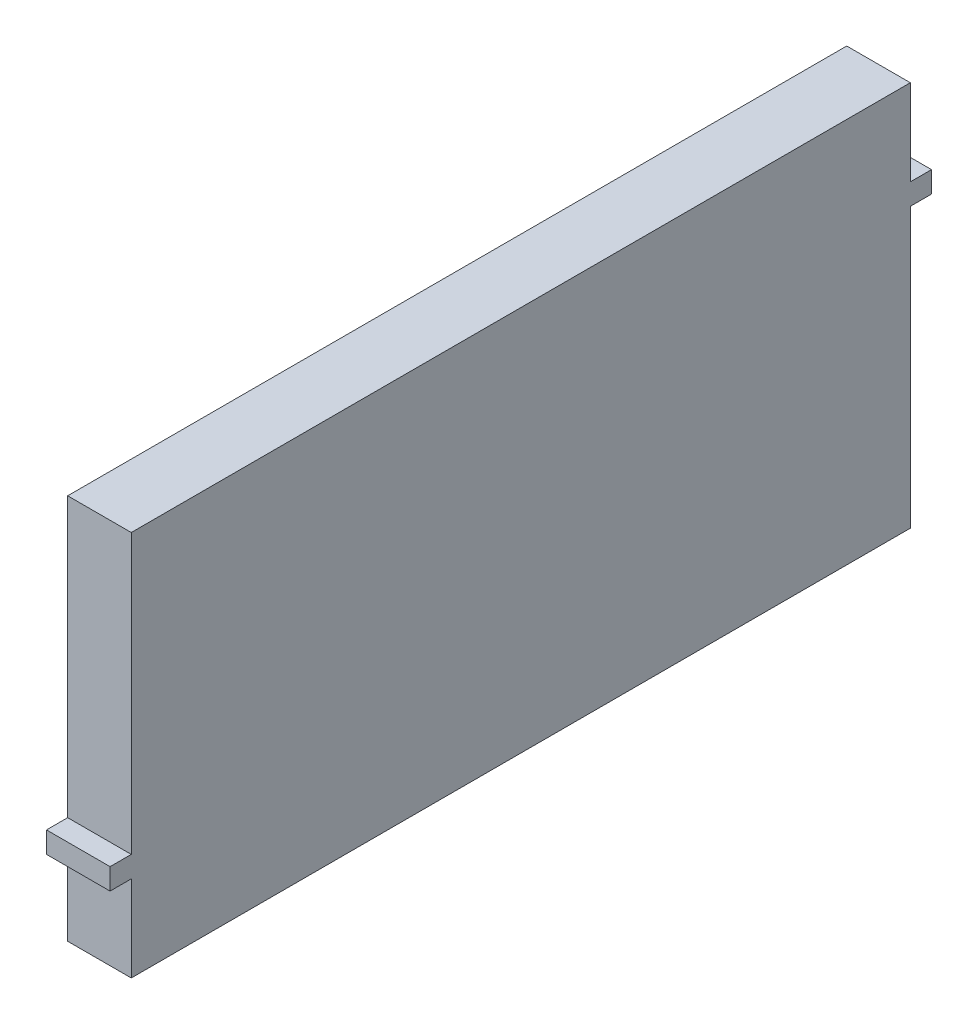
from build123d import *

# Parameters (mm, degrees)
BOSS_EXTRUDE1_DEPTH = 9.525


with BuildPart() as part:
    # Sketch1 → Boss-Extrude1 (new body)
    with BuildSketch(Plane(origin=(243.017706631, 0, 0), x_dir=(0, 0, -1), z_dir=(1, 0, 0))):
        Polygon((-439.537444078, 406.659208455), (-442.712444078, 406.659208455), (-442.712444078, 419.517958455), (-559.393694078, 419.517958455), (-559.393694078, 377.766708455), (-562.568694078, 377.766708455), (-562.568694078, 374.591708455), (-559.393694078, 374.591708455), (-559.393694078, 361.732958455), (-442.712444078, 361.732958455), (-442.712444078, 403.484208455), (-439.537444078, 403.484208455), align=None)
    extrude(amount=BOSS_EXTRUDE1_DEPTH)


solid = part.part
